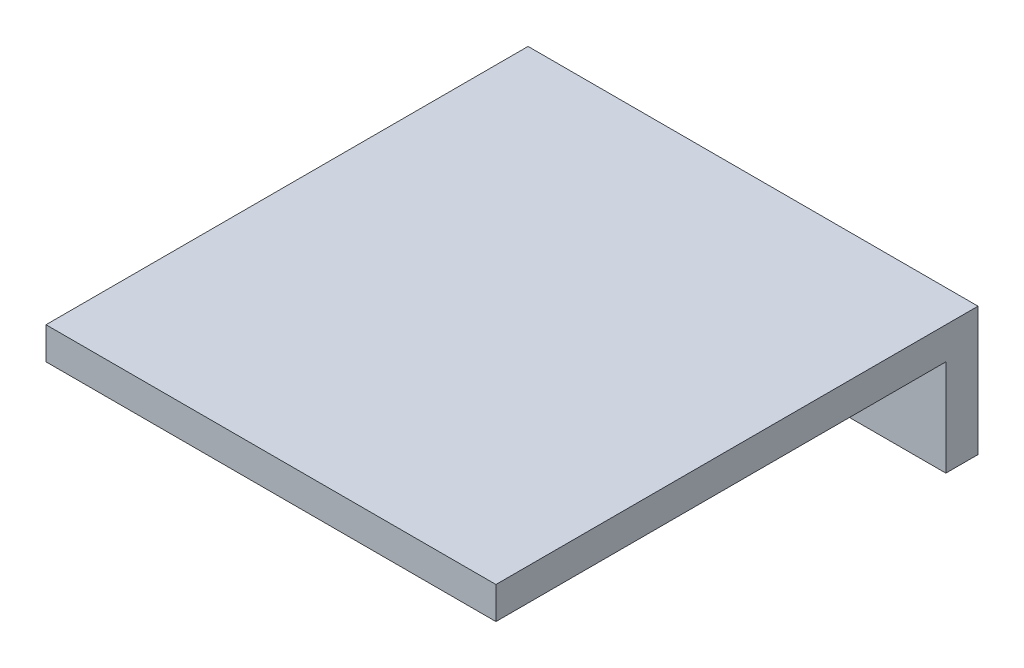
from build123d import *

# Parameters (mm, degrees)
ESQUISSE1_W             = 70
ESQUISSE1_H             = 20
BOSS_EXTRU_1_DEPTH      = 5
ESQUISSE2_W             = 70
ESQUISSE2_H             = 5
BOSS_EXTRU_2_DEPTH      = 70
ESQUISSE3_R             = 1.5
ENL_V_MAT_EXTRU_1_DEPTH = 60


with BuildPart() as part:
    # Esquisse1 → Boss.-Extru.1 (new body)
    with BuildSketch(Plane.XY):
        with Locations((-35, 10)):
            Rectangle(ESQUISSE1_W, ESQUISSE1_H)
    extrude(amount=BOSS_EXTRU_1_DEPTH)

    # Esquisse2 → Boss.-Extru.2 (add)
    with BuildSketch(Plane.XY.offset(5)):
        with Locations((-35, 17.5)):
            Rectangle(ESQUISSE2_W, ESQUISSE2_H)
    extrude(amount=BOSS_EXTRU_2_DEPTH)

    # Esquisse3 → Enlèv. mat.-Extru.1 (cut)
    with BuildSketch(Plane(origin=(0, 0, 0), x_dir=(-1, 0, 0), z_dir=(0, 0, -1))):
        with Locations((35, 3.26755804)):
            Circle(ESQUISSE3_R)
    extrude(amount=-ENL_V_MAT_EXTRU_1_DEPTH, mode=Mode.SUBTRACT)


solid = part.part
